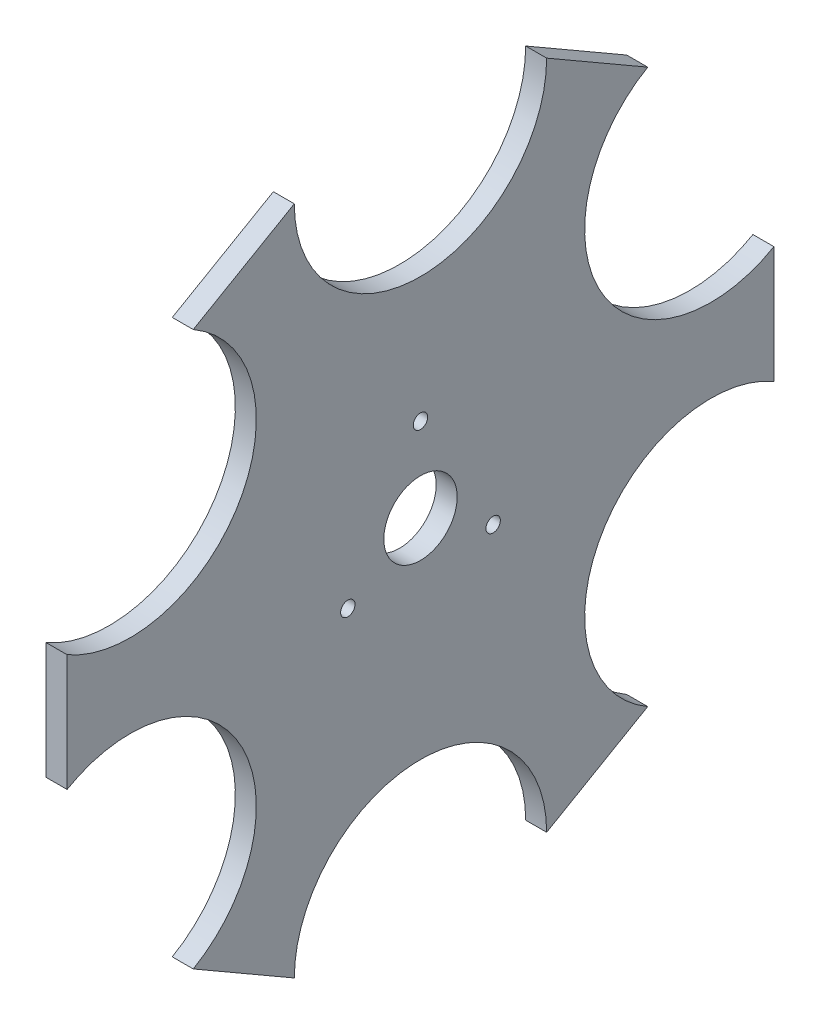
from build123d import *

# Parameters (mm, degrees)
SKETCH1_R                        = 11.110595
BOSS_EXTRUDE1_DEPTH              = 6.35
F_11_64_0_17188_DIAMETER_HOLE1_D = 4.365752
CIRPATTERN1_COUNT                = 3


with BuildPart() as part:
    # Sketch1 → Boss-Extrude1 (new body)
    with BuildSketch(Plane(origin=(0, 0, 0), x_dir=(0, 0, -1), z_dir=(1, 0, 0))):
        with BuildLine():
            Line((38.200000054, 101.5), (68.801578457, 83.832170471))
            ThreePointArc((68.801578457, 83.832170471), (54.819408013, 31.649999973), (107.001578511, 17.667829529))
            Line((107.001578511, 17.667829529), (107.001578511, -17.667829529))
            ThreePointArc((107.001578511, -17.667829529), (54.819408013, -31.649999973), (68.801578457, -83.832170471))
            Line((68.801578457, -83.832170471), (38.200000054, -101.5))
            ThreePointArc((38.200000054, -101.5), (0, -63.299999946), (-38.200000054, -101.5))
            Line((-38.200000054, -101.5), (-68.801578457, -83.832170471))
            ThreePointArc((-68.801578457, -83.832170471), (-54.819408013, -31.649999973), (-107.001578511, -17.667829529))
            Line((-107.001578511, -17.667829529), (-107.001578511, 17.667829529))
            ThreePointArc((-107.001578511, 17.667829529), (-54.819408013, 31.649999973), (-68.801578457, 83.832170471))
            Line((-68.801578457, 83.832170471), (-38.200000054, 101.5))
            ThreePointArc((-38.200000054, 101.5), (0, 63.299999946), (38.200000054, 101.5))
        make_face()
        Circle(SKETCH1_R, mode=Mode.SUBTRACT)
    extrude(amount=BOSS_EXTRUDE1_DEPTH)

    # 11/64 (0.17188) Diameter Hole1 (through all)
    with Locations(Plane(origin=(6.35, 0, 0), x_dir=(0, 0, -1), z_dir=(1, 0, 0))):
        with Locations((0, 25.4)):
            f_11_64_0_17188_diameter_hole1 = Hole(F_11_64_0_17188_DIAMETER_HOLE1_D / 2)

    # CirPattern1: 11/64 (0.17188) Diameter Hole1 ×3 about axis
    cirpattern1_axis = Axis((0, 0, 0), (1, 0, 0))
    for i in range(1, CIRPATTERN1_COUNT):
        add(f_11_64_0_17188_diameter_hole1.rotate(cirpattern1_axis, i * 360 / CIRPATTERN1_COUNT), mode=Mode.SUBTRACT)


solid = part.part
